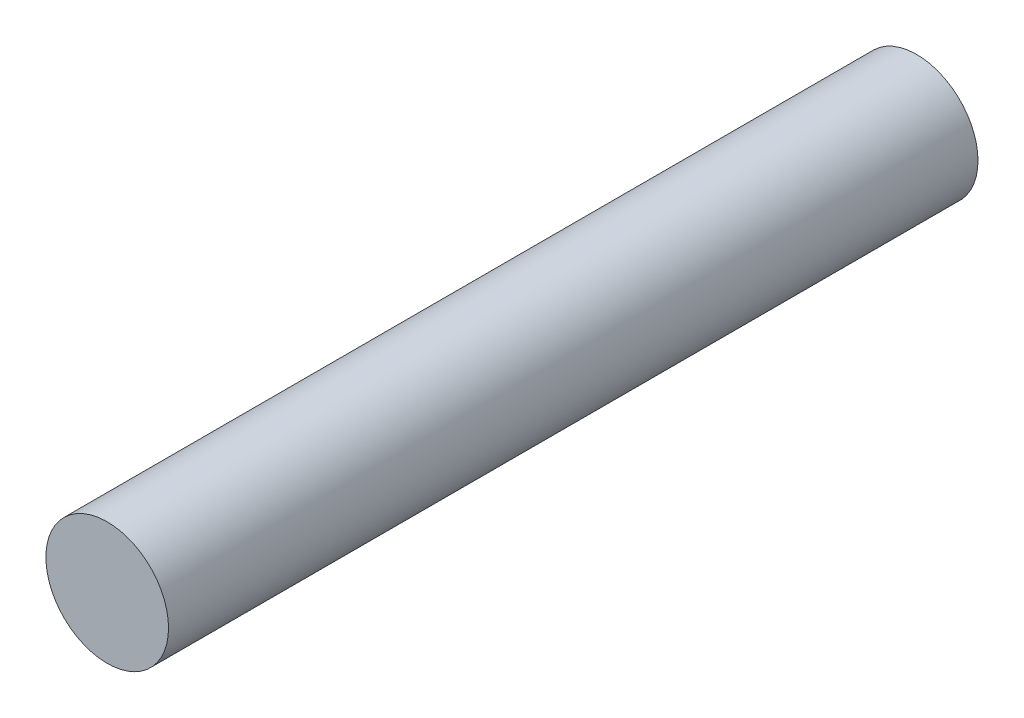
from build123d import *

# Parameters (mm, degrees)
SKETCH1_R           = 2.5
BOSS_EXTRUDE1_DEPTH = 33


with BuildPart() as part:
    # Sketch1 → Boss-Extrude1 (new body)
    with BuildSketch(Plane.XY):
        with Locations((-40.983162755, 47.501201816)):
            Circle(SKETCH1_R)
    extrude(amount=BOSS_EXTRUDE1_DEPTH)


solid = part.part
